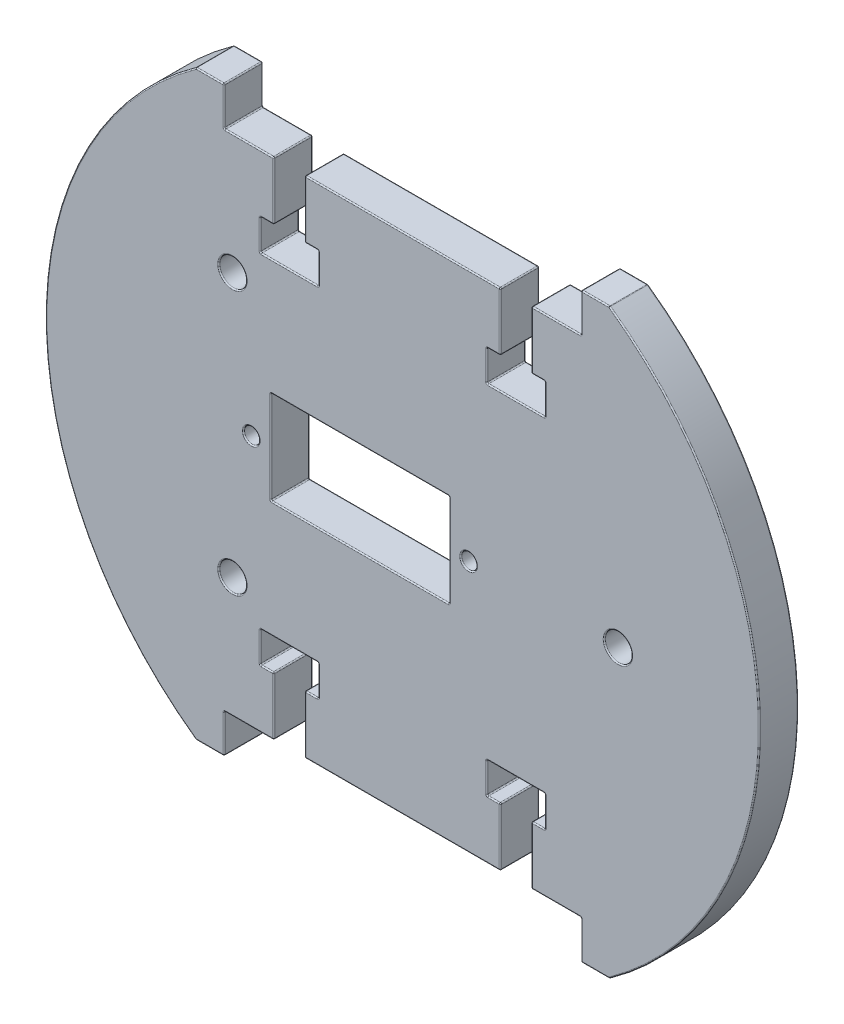
from build123d import *

# Parameters (mm, degrees)
SKETCH1_R           = 1
SKETCH1_R_2         = 1.75
SKETCH1_W           = 23
SKETCH1_H           = 12
BOSS_EXTRUDE1_DEPTH = 5
CUT_EXTRUDE1_DEPTH  = 60.558794481
FILLET1_R           = 0.15


with BuildPart() as part:
    # Sketch1 → Boss-Extrude1 (new body)
    with BuildSketch(Plane.XY):
        with BuildLine():
            Line((-26.64113361, 37.5), (-23, 37.5))
            Line((-23, 37.5), (-23, 32.5))
            Line((-23, 32.5), (23, 32.5))
            Line((23, 32.5), (23, 37.5))
            Line((23, 37.5), (26.64113361, 37.5))
            ThreePointArc((26.64113361, 37.5), (46, 0), (26.64113361, -37.5))
            Line((26.64113361, -37.5), (23, -37.5))
            Line((23, -37.5), (23, -32.5))
            Line((23, -32.5), (-23, -32.5))
            Line((-23, -32.5), (-23, -37.5))
            Line((-23, -37.5), (-26.64113361, -37.5))
            ThreePointArc((-26.64113361, -37.5), (-46, 0), (-26.64113361, 37.5))
        make_face()
        with Locations((-19.5, 0)):
            Circle(SKETCH1_R, mode=Mode.SUBTRACT)
        with Locations((8.5, 0)):
            Circle(SKETCH1_R, mode=Mode.SUBTRACT)
        with Locations((-21.93, 17)):
            Circle(SKETCH1_R_2, mode=Mode.SUBTRACT)
        with Locations((-21.93, -17)):
            Circle(SKETCH1_R_2, mode=Mode.SUBTRACT)
        with Locations((27.75, 0)):
            Circle(SKETCH1_R_2, mode=Mode.SUBTRACT)
        with Locations((-5.5, 0)):
            Rectangle(SKETCH1_W, SKETCH1_H, mode=Mode.SUBTRACT)
    extrude(amount=BOSS_EXTRUDE1_DEPTH)

    # Sketch4 → Cut-Extrude1 (cut, through all)
    with BuildSketch(Plane.XY.offset(5)):
        Polygon((-10.85, 25), (-12.6, 25), (-12.6, 32.5), (-16.6, 32.5), (-16.6, 25), (-18.35, 25), (-18.35, 21), (-10.85, 21), align=None)
        Polygon((10.85, 21), (18.35, 21), (18.35, 25), (16.6, 25), (16.6, 32.5), (12.6, 32.5), (12.6, 25), (10.85, 25), align=None)
        Polygon((10.85, -25), (12.6, -25), (12.6, -32.5), (16.6, -32.5), (16.6, -25), (18.35, -25), (18.35, -21), (10.85, -21), align=None)
        Polygon((-10.85, -21), (-18.35, -21), (-18.35, -25), (-16.6, -25), (-16.6, -32.5), (-12.6, -32.5), (-12.6, -25), (-10.85, -25), align=None)
    extrude(amount=-CUT_EXTRUDE1_DEPTH, mode=Mode.SUBTRACT)

    # Fillet1
    fillet1_edges = [part.edges().sort_by_distance(p)[0] for p in [
        (46, 0, 5),
        (16.6, -28.75, 5),
        (16.6, -25, 2.5),
        (16.6, -32.5, 2.5),
        (12.6, -28.75, 0),
        (12.6, -32.5, 2.5),
        (11.725, -25, 0),
        (12.6, -25, 2.5),
        (10.85, -23, 0),
        (10.85, -25, 2.5),
        (14.6, -21, 5),
        (10.85, -21, 2.5),
        (18.35, -23, 5),
        (18.35, -21, 2.5),
        (17.475, -25, 0),
        (18.35, -25, 2.5),
        (16.6, -28.75, 0),
        (14.6, -21, 0),
        (18.35, -23, 0),
        (17.475, -25, 5),
        (-19.8, -32.5, 0),
        (10.85, -23, 5),
        (11.725, -25, 5),
        (12.6, -28.75, 5),
        (-23, -35, 0),
        (-24.820566805, -37.5, 0),
        (-46, 0, 0),
        (0, 32.5, 0),
        (0, 32.5, 5),
        (-24.820566805, 37.5, 0),
        (-23, 35, 0),
        (10.85, 23, 5),
        (10.85, 21, 2.5),
        (24.820566805, 37.5, 5),
        (11.725, 25, 5),
        (10.85, 25, 2.5),
        (12.6, 28.75, 5),
        (12.6, 25, 2.5),
        (12.6, 32.5, 2.5),
        (16.6, 28.75, 0),
        (16.6, 32.5, 2.5),
        (17.475, 25, 5),
        (16.6, 25, 2.5),
        (18.35, 23, 0),
        (18.35, 25, 2.5),
        (14.6, 21, 0),
        (19.8, 32.5, 0),
        (18.35, 21, 2.5),
        (10.85, 23, 0),
        (11.725, 25, 0),
        (12.6, 28.75, 0),
        (17.475, 25, 0),
        (14.6, 21, 5),
        (18.35, 23, 5),
        (16.6, 28.75, 5),
        (23, 35, 0),
        (24.820566805, 37.5, 0),
        (46, 0, 0),
        (-19.8, 32.5, 0),
        (-19.8, 32.5, 5),
        (24.820566805, -37.5, 0),
        (23, -35, 0),
        (-14.6, 21, 5),
        (-10.85, 21, 2.5),
        (-18.35, 23, 5),
        (-18.35, 21, 2.5),
        (-10.85, 23, 0),
        (-10.85, 25, 2.5),
        (-10.85, 23, 5),
        (-11.725, 25, 5),
        (-12.6, 28.75, 5),
        (-17.475, 25, 5),
        (-18.35, 23, 0),
        (-16.6, 28.75, 0),
        (-14.6, 21, 0),
        (-11.725, 25, 0),
        (-12.6, 25, 2.5),
        (-17.475, 25, 0),
        (23, 35, 5),
        (-18.35, 25, 2.5),
        (-16.6, 32.5, 2.5),
        (-12.6, 28.75, 0),
        (-12.6, 32.5, 2.5),
        (-16.6, 28.75, 5),
        (-16.6, 25, 2.5),
        (19.8, 32.5, 5),
        (23, -32.5, 2.5),
        (-23, -32.5, 2.5),
        (-23, -37.5, 2.5),
        (-26.64113361, -37.5, 2.5),
        (-26.64113361, 37.5, 2.5),
        (-23, 37.5, 2.5),
        (-23, 32.5, 2.5),
        (23, 32.5, 2.5),
        (23, 37.5, 2.5),
        (26.64113361, 37.5, 2.5),
        (26.64113361, -37.5, 2.5),
        (23, -37.5, 2.5),
        (-23, 35, 5),
        (-24.820566805, 37.5, 5),
        (-46, 0, 5),
        (-24.820566805, -37.5, 5),
        (6, 0, 0),
        (6, -6, 2.5),
        (-5.5, 6, 0),
        (6, 6, 2.5),
        (-17, 0, 0),
        (-17, 6, 2.5),
        (-5.5, -6, 0),
        (-17, -6, 2.5),
        (-23, -35, 5),
        (6, 0, 5),
        (-5.5, 6, 5),
        (-17, 0, 5),
        (-5.5, -6, 5),
        (-19.8, -32.5, 5),
        (23, -35, 5),
        (-20.5, 0, 0),
        (-20.5, 0, 5),
        (7.5, 0, 0),
        (7.5, 0, 5),
        (-23.68, 17, 0),
        (-23.68, 17, 5),
        (-23.68, -17, 0),
        (-23.68, -17, 5),
        (26, 0, 0),
        (26, 0, 5),
        (24.820566805, -37.5, 5),
        (0, -32.5, 0),
        (0, -32.5, 5),
        (-14.6, -21, 0),
        (-18.35, -21, 2.5),
        (-10.85, -23, 5),
        (-10.85, -21, 2.5),
        (-18.35, -23, 0),
        (-18.35, -25, 2.5),
        (-14.6, -21, 5),
        (-18.35, -23, 5),
        (-16.6, -28.75, 5),
        (-10.85, -23, 0),
        (-11.725, -25, 0),
        (-12.6, -28.75, 0),
        (-17.475, -25, 0),
        (-16.6, -25, 2.5),
        (-17.475, -25, 5),
        (-10.85, -25, 2.5),
        (-11.725, -25, 5),
        (-12.6, -32.5, 2.5),
        (-16.6, -28.75, 0),
        (-16.6, -32.5, 2.5),
        (-12.6, -28.75, 5),
        (-12.6, -25, 2.5),
        (19.8, -32.5, 0),
        (19.8, -32.5, 5),
    ]]
    fillet(fillet1_edges, radius=FILLET1_R)


solid = part.part
